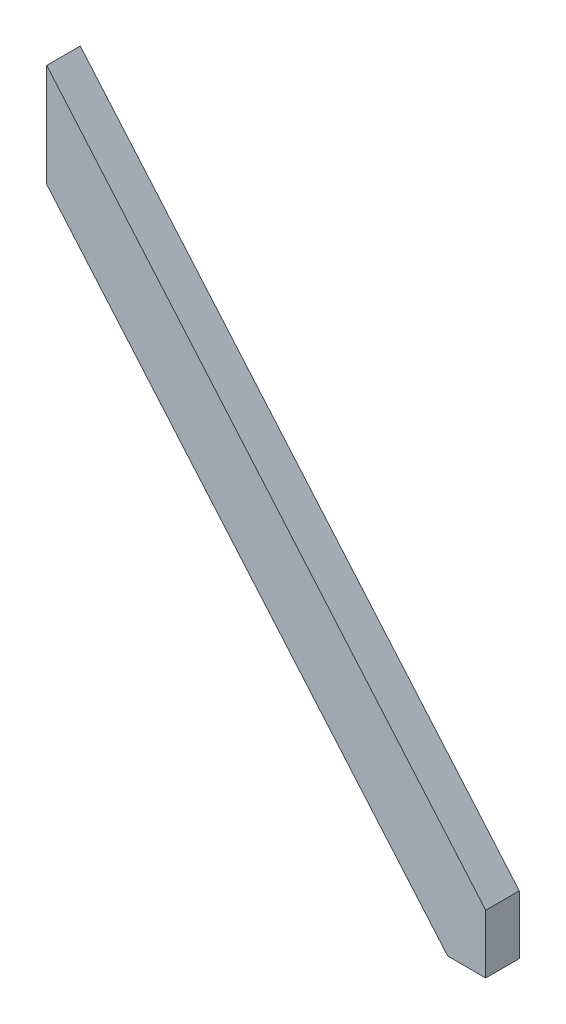
from build123d import *

# Parameters (mm, degrees)
BOSS_EXTRUDE1_DEPTH = 50.8


with BuildPart() as part:
    # Sketch1 → Boss-Extrude1 (new body)
    with BuildSketch(Plane.XY):
        Polygon((-57.614655043, -44.45), (-665, 664.15), (-665, 820.265557475), (0, 44.45), (0, -44.45), align=None)
    extrude(amount=BOSS_EXTRUDE1_DEPTH)


solid = part.part
